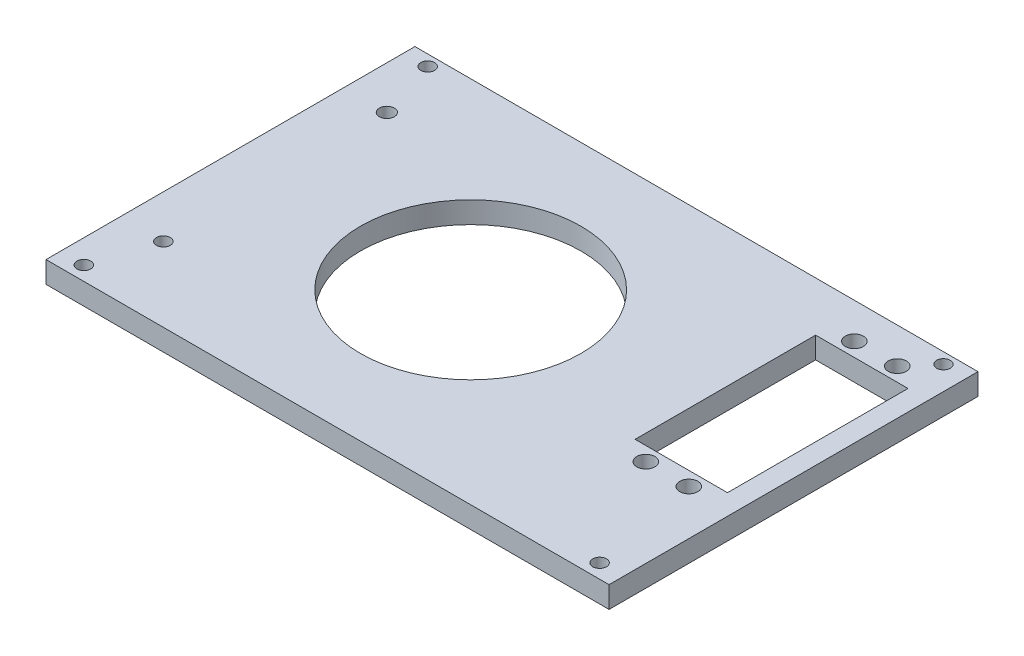
from build123d import *

# Parameters (mm, degrees)
SKETCH1_W           = 131
SKETCH1_H           = 85.8357277
SKETCH1_R           = 1.6
SKETCH1_R_2         = 2.1
SKETCH1_R_3         = 1.75
SKETCH1_R_4         = 25.65
SKETCH1_W_2         = 21.5
SKETCH1_H_2         = 42
BOSS_EXTRUDE1_DEPTH = 5


with BuildPart() as part:
    # Sketch1 → Boss-Extrude1 (new body)
    with BuildSketch(Plane(origin=(0, 0, 0), x_dir=(1, 0, 0), z_dir=(0, 1, 0))):
        with Locations((0, -0.385889954)):
            Rectangle(SKETCH1_W, SKETCH1_H)
        with Locations(Location((-55.5, -26, 0), (0, 0, 270))):
            Circle(SKETCH1_R, mode=Mode.SUBTRACT)
        with Locations(Location((-60, -40, 0), (0, 0, 270))):
            Circle(SKETCH1_R, mode=Mode.SUBTRACT)
        with Locations(Location((60, -40, 0), (0, 0, 270))):
            Circle(SKETCH1_R, mode=Mode.SUBTRACT)
        with Locations(Location((60, 40, 0), (0, 0, 270))):
            Circle(SKETCH1_R, mode=Mode.SUBTRACT)
        with Locations(Location((45, 34.25, 0), (0, 0, 270))):
            Circle(SKETCH1_R_2, mode=Mode.SUBTRACT)
        with Locations(Location((55, 34.25, 0), (0, 0, 270))):
            Circle(SKETCH1_R_2, mode=Mode.SUBTRACT)
        with Locations(Location((-55.5, 26, 0), (0, 0, 270))):
            Circle(SKETCH1_R_3, mode=Mode.SUBTRACT)
        with Locations(Location((45, -14.25, 0), (0, 0, 270))):
            Circle(SKETCH1_R_2, mode=Mode.SUBTRACT)
        with Locations(Location((-10, 0, 0), (0, 0, 270))):
            Circle(SKETCH1_R_4, mode=Mode.SUBTRACT)
        with Locations(Location((-60, 40, 0), (0, 0, 270))):
            Circle(SKETCH1_R, mode=Mode.SUBTRACT)
        with Locations(Location((55, -14.25, 0), (0, 0, 270))):
            Circle(SKETCH1_R_2, mode=Mode.SUBTRACT)
        with Locations((50, 10)):
            Rectangle(SKETCH1_W_2, SKETCH1_H_2, mode=Mode.SUBTRACT)
    extrude(amount=BOSS_EXTRUDE1_DEPTH)


solid = part.part
